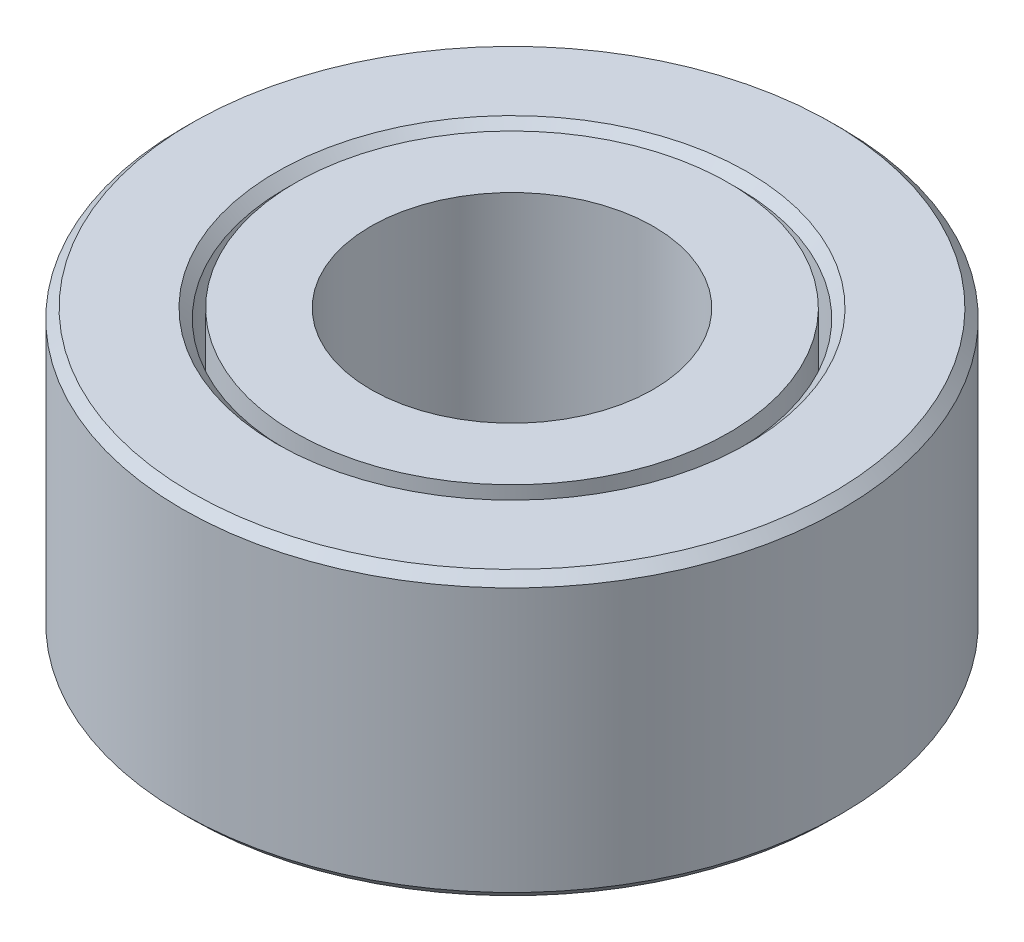
from build123d import *

# Parameters (mm, degrees)
ESQUISSE1_R          = 3.5
ESQUISSE1_R_2        = 2.4
BOSS_EXTRU_1_DEPTH   = 3
ESQUISSE1_R_3        = 2.3
ESQUISSE1_R_4        = 1.5
BOSS_EXTRU_1_2_DEPTH = 3
CHANFREIN1_SIZE      = 0.1


with BuildPart() as part:
    # Esquisse1 → Boss.-Extru.1 (new body)
    with BuildSketch(Plane(origin=(0, 0, 0), x_dir=(1, 0, 0), z_dir=(0, 1, 0))):
        with Locations(Location((0, 0, 0), (0, 0, 270))):
            Circle(ESQUISSE1_R)
        with Locations(Location((0, 0, 0), (0, 0, 270))):
            Circle(ESQUISSE1_R_2, mode=Mode.SUBTRACT)
    extrude(amount=BOSS_EXTRU_1_DEPTH)

    # Chanfrein1
    chanfrein1_edges = [part.edges().sort_by_distance(p)[0] for p in [
        (0, 0, -3.5),
        (0, 0, -2.4),
        (0, 3, -2.4),
        (0, 3, -3.5),
    ]]
    chamfer(chanfrein1_edges, length=CHANFREIN1_SIZE)


with BuildPart() as body_2:
    # Esquisse1 → Boss.-Extru.1 2 (new body)
    with BuildSketch(Plane(origin=(0, 0, 0), x_dir=(1, 0, 0), z_dir=(0, 1, 0))):
        with Locations(Location((0, 0, 0), (0, 0, 270))):
            Circle(ESQUISSE1_R_3)
        with Locations(Location((0, 0, 0), (0, 0, 270))):
            Circle(ESQUISSE1_R_4, mode=Mode.SUBTRACT)
    extrude(amount=BOSS_EXTRU_1_2_DEPTH)


solid = Compound([part.part, body_2.part])
